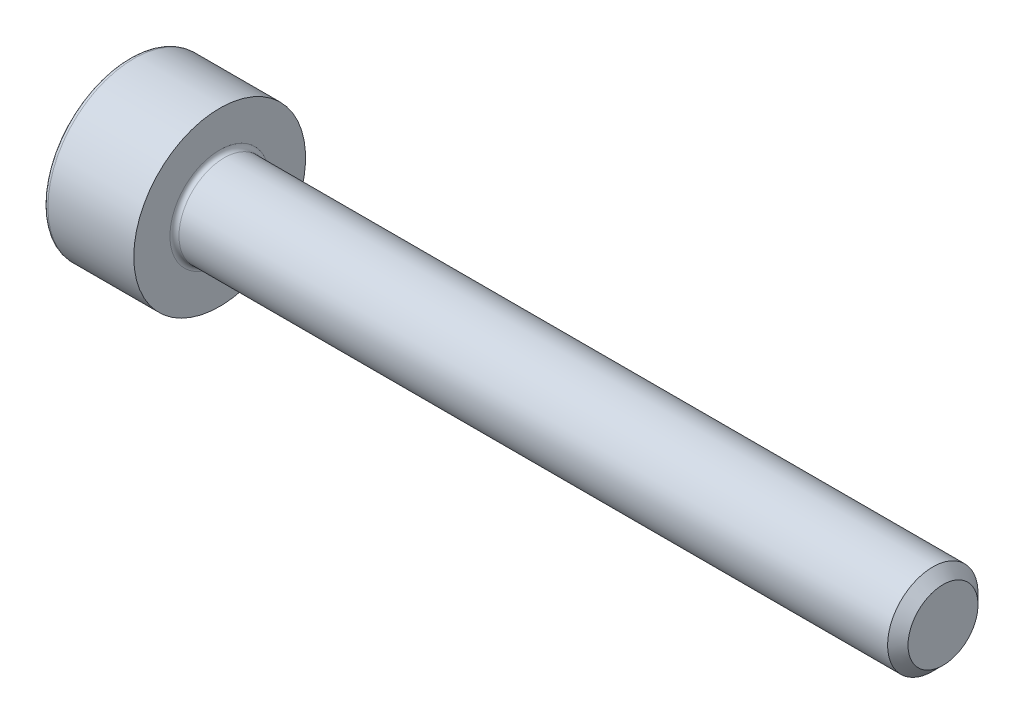
from build123d import *

# Parameters (mm, degrees)
FILLET1_R   = 0.1
FILLET2_R   = 0.1
HEX_2_DEPTH = 1


with BuildPart() as part:
    # BodySke → Base-Revolve (revolve)
    with BuildSketch(Plane.XY, mode=Mode.PRIVATE) as base_revolve_sk:
        Polygon((0, 0), (0, 1.9), (2, 1.9), (2, 1), (17.774, 1), (18, 0.774), (18, 0), align=None)
    revolve(base_revolve_sk.sketch.rotate(Axis((-31.75, 0, 0), (1, 0, 0)), 90), axis=Axis((-31.75, 0, 0), (1, 0, 0)))

    # Fillet1
    fillet1_edges = [part.edges().sort_by_distance(p)[0] for p in [
        (2, 0, -1),
    ]]
    fillet(fillet1_edges, radius=FILLET1_R)

    # Fillet2
    fillet2_edges = [part.edges().sort_by_distance(p)[0] for p in [
        (0, 0, -1.9),
    ]]
    fillet(fillet2_edges, radius=FILLET2_R)

    # Sketch2 → Hex-PreBroach (revolve, cut)
    with BuildSketch(Plane.XY, mode=Mode.PRIVATE) as hex_prebroach_sk:
        Polygon((0, 0.7725), (1, 0.7725), (1.446003083, 0), (0, 0), align=None)
    revolve(hex_prebroach_sk.sketch.rotate(Axis((0, 0, 0), (1, 0, 0)), 90), axis=Axis((0, 0, 0), (1, 0, 0)), mode=Mode.SUBTRACT)

    # Sketch3 → Hex 2 (cut)
    with BuildSketch(Plane(origin=(0, 0, 0), x_dir=(0, 0.500000000000001, 0.866025403784438), z_dir=(-1, 0, 0))):
        Polygon((0.446003083, 0.7725), (-0.446003083, 0.7725), (-0.892006166, 0), (-0.446003083, -0.7725), (0.446003083, -0.7725), (0.892006166, 0), align=None)
    extrude(amount=-HEX_2_DEPTH, mode=Mode.SUBTRACT)


solid = part.part
